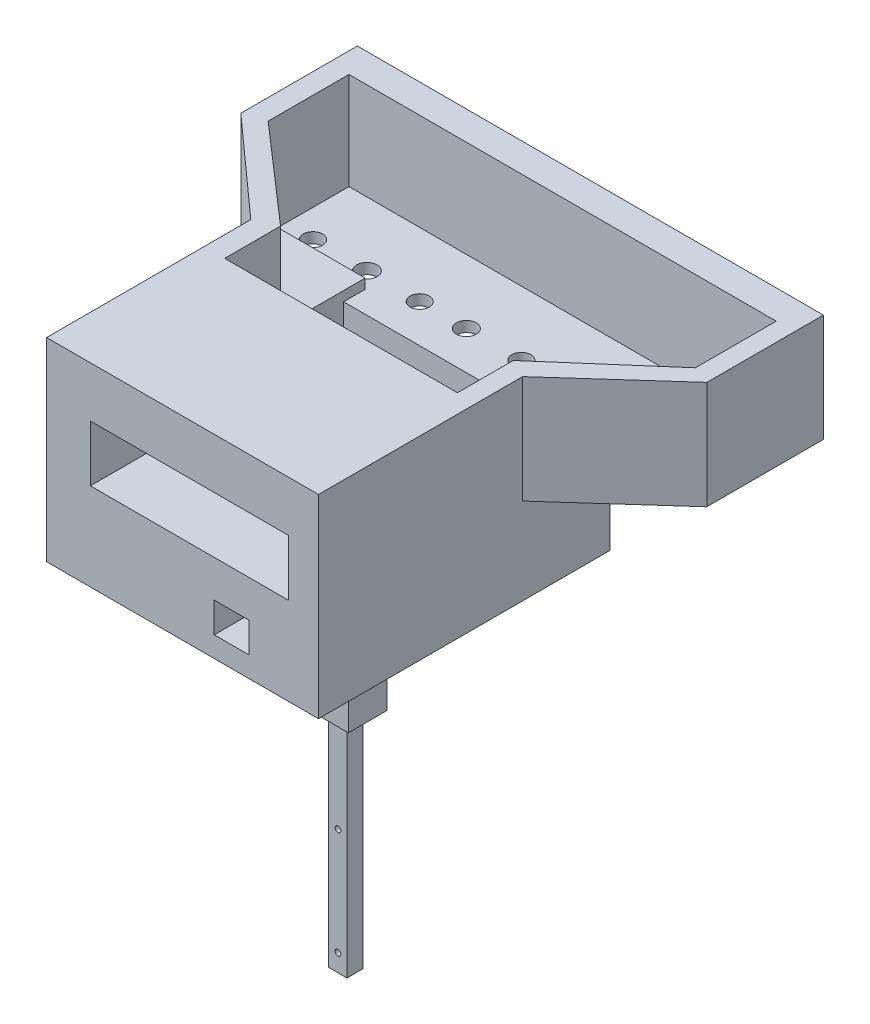
from build123d import *

# Parameters (mm, degrees)
SKETCH_8_W           = 140
SKETCH_8_H           = 130
EXTRUDE_2_DEPTH      = 100
SKETCH_9_W           = 119.853608507
SKETCH_9_H           = 114.241733861
CUT_EXTRUDE_2_DEPTH  = 90
SKETCH_10_W          = 140
SKETCH_10_H          = 55.45062913
EXTRUDE_3_DEPTH      = 60
SKETCH_11_W          = 119.853608507
SKETCH_11_H          = 52.765862156
CUT_EXTRUDE_3_DEPTH  = 50
SKETCH_12_W          = 60
SKETCH_12_H          = 55.45062913
EXTRUDE_4_DEPTH      = 50
SKETCH_13_W          = 60
SKETCH_13_H          = 55.45062913
EXTRUDE_5_DEPTH      = 50
SKETCH_15_W          = 41.61767962
SKETCH_15_H          = 50
CUT_EXTRUDE_5_DEPTH  = 50
SKETCH_16_W          = 41.61767962
SKETCH_16_H          = 49.940605531
CUT_EXTRUDE_6_DEPTH  = 220
SKETCH_18_W          = 140
SKETCH_18_H          = 100
EXTRUDE_6_DEPTH      = 20
SKETCH_19_W          = 119.853608507
SKETCH_19_H          = 90
CUT_EXTRUDE_7_DEPTH  = 17
CUT_EXTRUDE_8_DEPTH  = 17
SKETCH_29_R          = 5.01352521
SKETCH_29_R_2        = 5.249816441
SKETCH_29_R_3        = 4.93835751
SKETCH_29_R_4        = 5.104719563
SKETCH_29_R_5        = 4.942569228
SKETCH_29_R_6        = 5.218376227
SKETCH_29_R_7        = 5.109275874
SKETCH_29_R_8        = 4.846735289
CUT_EXTRUDE_9_DEPTH  = 17
EXTRUDE_9_DEPTH      = 4
SKETCH_37_W          = 2
SKETCH_37_H          = 96
EXTRUDE_10_DEPTH     = 4
SKETCH_39_W          = 84
SKETCH_39_H          = 94.106669422
CUT_EXTRUDE_10_DEPTH = 4
SKETCH_40_W          = 2.323035316
SKETCH_40_H          = 2.081311216
CUT_EXTRUDE_12_DEPTH = 94
SKETCH_42_W          = 2.095402412
SKETCH_42_H          = 1.958248824
CUT_EXTRUDE_13_DEPTH = 94
SKETCH_43_W          = 9.619264996
SKETCH_43_H          = 8.129833148
EXTRUDE_11_DEPTH     = 135
SKETCH_44_R          = 1.5
CUT_EXTRUDE_14_DEPTH = 40
SKETCH_45_W          = 19.969543159
SKETCH_45_H          = 19.838905337
EXTRUDE_12_DEPTH     = 20
EXTRUDE_13_DEPTH     = 55.5
CUT_EXTRUDE_15_DEPTH = 45
SKETCH_50_W          = 119.853608507
SKETCH_50_H          = 70
EXTRUDE_14_DEPTH     = 90
SKETCH_51_W          = 102.080516597
SKETCH_51_H          = 36.944055187
CUT_EXTRUDE_17_DEPTH = 70
SKETCH_52_W          = 102.571773441
SKETCH_52_H          = 2.896860024
EXTRUDE_16_DEPTH     = 8
SKETCH_54_W          = 65.620335911
SKETCH_54_H          = 1.893330578
CUT_EXTRUDE_18_DEPTH = 4
SKETCH_55_W          = 6.653347609
SKETCH_55_H          = 11.160454054
EXTRUDE_17_DEPTH     = 8
SKETCH_56_W          = 4.450383643
SKETCH_56_H          = 9.96038244
EXTRUDE_18_DEPTH     = 8
SKETCH_57_R          = 1.5
CUT_EXTRUDE_19_DEPTH = 20
SKETCH_58_W          = 17.801534575
SKETCH_58_H          = 15.470381237
CUT_EXTRUDE_21_DEPTH = 45
SKETCH_59_W          = 17.801534575
SKETCH_59_H          = 13.564090588
CUT_EXTRUDE_22_DEPTH = 25
SKETCH_62_W          = 17.801534575
SKETCH_62_H          = 40.082559496
CUT_REVOLVE_1_ANGLE  = 45


with BuildPart() as part:
    # 草图8 → 凸台-拉伸2 (new body)
    with BuildSketch(Plane(origin=(0, 0, 0), x_dir=(1, 0, 0), z_dir=(0, 1, 0))):
        with Locations((1.794871795, 32.423076923)):
            Rectangle(SKETCH_8_W, SKETCH_8_H)
    extrude(amount=EXTRUDE_2_DEPTH)

    # 草图9 → 切除-拉伸2 (cut)
    with BuildSketch(Plane(origin=(0, 100, 0), x_dir=(1, 0, 0), z_dir=(0, 1, 0))):
        with Locations((2.262528015, 32.69030905)):
            Rectangle(SKETCH_9_W, SKETCH_9_H)
    extrude(amount=-CUT_EXTRUDE_2_DEPTH, mode=Mode.SUBTRACT)

    # 草图10 → 凸台-拉伸3 (add)
    with BuildSketch(Plane(origin=(0, 0, -97.423076923), x_dir=(-1, 0, 0), z_dir=(0, 0, -1))):
        with Locations((-1.794871795, 72.274685435)):
            Rectangle(SKETCH_10_W, SKETCH_10_H)
    extrude(amount=EXTRUDE_3_DEPTH)

    # 草图11 → 切除-拉伸3 (cut)
    with BuildSketch(Plane(origin=(0, 100, 0), x_dir=(1, 0, 0), z_dir=(0, 1, 0))):
        with Locations((2.262528015, 116.194107058)):
            Rectangle(SKETCH_11_W, SKETCH_11_H)
    extrude(amount=-CUT_EXTRUDE_3_DEPTH, mode=Mode.SUBTRACT)

    # 草图12 → 凸台-拉伸4 (add)
    with BuildSketch(Plane.ZY.offset(68.205128205)):
        with Locations((-127.423076923, 72.274685435)):
            Rectangle(SKETCH_12_W, SKETCH_12_H)
    extrude(amount=EXTRUDE_4_DEPTH)

    # 草图13 → 凸台-拉伸5 (add)
    with BuildSketch(Plane(origin=(71.794871795, 0, 0), x_dir=(0, 0, -1), z_dir=(1, 0, 0))):
        with Locations((127.423076923, 72.274685435)):
            Rectangle(SKETCH_13_W, SKETCH_13_H)
    extrude(amount=EXTRUDE_5_DEPTH)

    # 草图15 → 切除-拉伸5 (cut)
    with BuildSketch(Plane(origin=(-57.664276238, 0, 0), x_dir=(0, 0, -1), z_dir=(1, 0, 0))):
        with Locations((121.768198326, 75)):
            Rectangle(SKETCH_15_W, SKETCH_15_H)
    extrude(amount=-CUT_EXTRUDE_5_DEPTH, mode=Mode.SUBTRACT)

    # 草图16 → 切除-拉伸6 (cut)
    with BuildSketch(Plane(origin=(-107.664276238, 0, 0), x_dir=(0, 0, -1), z_dir=(1, 0, 0))):
        with Locations((121.768198326, 75.029697235)):
            Rectangle(SKETCH_16_W, SKETCH_16_H)
    extrude(amount=CUT_EXTRUDE_6_DEPTH, mode=Mode.SUBTRACT)

    # 草图18 → 凸台-拉伸6 (add)
    with BuildSketch(Plane.XY.offset(32.576923077)):
        with Locations((1.794871795, 50)):
            Rectangle(SKETCH_18_W, SKETCH_18_H)
    extrude(amount=EXTRUDE_6_DEPTH)

    # 草图19 → 切除-拉伸7 (cut)
    with BuildSketch(Plane(origin=(0, 0, 24.430557881), x_dir=(-1, 0, 0), z_dir=(0, 0, -1))):
        with Locations((-2.262528015, 55)):
            Rectangle(SKETCH_19_W, SKETCH_19_H)
    extrude(amount=-CUT_EXTRUDE_7_DEPTH, mode=Mode.SUBTRACT)

    # 草图20 → 切除-拉伸8 (cut)
    with BuildSketch(Plane.XZ):
        with BuildLine():
            Line((-42.997677053, -75), (-22.997677053, -75))
            ThreePointArc((-22.997677053, -75), (-17.997677053, -80), (-22.997677053, -85))
            Line((-22.997677053, -85), (-42.997677053, -85))
            ThreePointArc((-42.997677053, -85), (-47.997677053, -80), (-42.997677053, -75))
        make_face()
        with BuildLine():
            Line((22.997677053, -85), (42.997677053, -85))
            ThreePointArc((42.997677053, -85), (47.997677053, -80), (42.997677053, -75))
            Line((42.997677053, -75), (22.997677053, -75))
            ThreePointArc((22.997677053, -75), (17.997677053, -80), (22.997677053, -85))
        make_face()
    extrude(amount=-CUT_EXTRUDE_8_DEPTH, mode=Mode.SUBTRACT)

    # 草图29 → 切除-拉伸9 (cut)
    with BuildSketch(Plane.XZ.offset(-44.54937087)):
        with Locations(Location((-93.309871888, -109.657200503, 0), (0, 0, 270))):
            Circle(SKETCH_29_R)
        with Locations(Location((-65.511669659, -109.657200503, 0), (0, 0, 270))):
            Circle(SKETCH_29_R_2)
        with Locations(Location((-38.174617175, -109.525727046, 0), (0, 0, 270))):
            Circle(SKETCH_29_R_3)
        with Locations(Location((-14.155387991, -109.525727046, 0), (0, 0, 270))):
            Circle(SKETCH_29_R_4)
        with Locations(Location((14.155387991, -109.525727046, 0), (0, 0, 270))):
            Circle(SKETCH_29_R_5)
        with Locations(Location((38.174617175, -109.525727046, 0), (0, 0, 270))):
            Circle(SKETCH_29_R_6)
        with Locations(Location((65.511669659, -109.657200503, 0), (0, 0, 270))):
            Circle(SKETCH_29_R_7)
        with Locations(Location((93.309871888, -109.657200503, 0), (0, 0, 270))):
            Circle(SKETCH_29_R_8)
    extrude(amount=-CUT_EXTRUDE_9_DEPTH, mode=Mode.SUBTRACT)

    # 草图17 → 凸台-拉伸9 (add)
    with BuildSketch(Plane(origin=(0, 0, 0), x_dir=(-1, 0, 0), z_dir=(0, -1, 0))):
        Polygon((44.206117019, 0), (44.206117019, -45.225446523), (-43.793882981, -45.225446523), (-43.793882981, 0), (-43.793882981, 50.774553477), (44.206117019, 50.774553477), align=None)
    extrude(amount=EXTRUDE_9_DEPTH)

    # 草图37 → 凸台-拉伸10 (add)
    with BuildSketch(Plane.XZ.offset(4)):
        with Locations((-45.206117019, -2.774553477)):
            Rectangle(SKETCH_37_W, SKETCH_37_H)
        with Locations((44.793882981, -2.774553477)):
            Rectangle(SKETCH_37_W, SKETCH_37_H)
    extrude(amount=-EXTRUDE_10_DEPTH)

    # 草图39 → 切除-拉伸10 (cut)
    with BuildSketch(Plane.XZ.offset(4)):
        with Locations((0, -3.721218766)):
            Rectangle(SKETCH_39_W, SKETCH_39_H)
    extrude(amount=-CUT_EXTRUDE_10_DEPTH, mode=Mode.SUBTRACT)

    # 草图40 → 切除-拉伸12 (cut)
    with BuildSketch(Plane(origin=(0, 0, -50.774553477), x_dir=(-1, 0, 0), z_dir=(0, 0, -1))):
        with Locations((43.161517658, -1.040655608)):
            Rectangle(SKETCH_40_W, SKETCH_40_H)
    extrude(amount=-CUT_EXTRUDE_12_DEPTH, mode=Mode.SUBTRACT)

    # 草图42 → 切除-拉伸13 (cut)
    with BuildSketch(Plane(origin=(0, 0, -50.774553477), x_dir=(-1, 0, 0), z_dir=(0, 0, -1))):
        with Locations((-43.047701206, -0.979124412)):
            Rectangle(SKETCH_42_W, SKETCH_42_H)
    extrude(amount=-CUT_EXTRUDE_13_DEPTH, mode=Mode.SUBTRACT)

    # 草图43 → 凸台-拉伸11 (add)
    with BuildSketch(Plane.XZ):
        with Locations((54.952979828, 21.790363097)):
            Rectangle(SKETCH_43_W, SKETCH_43_H)
    extrude(amount=EXTRUDE_11_DEPTH)

    # 草图44 → 切除-拉伸14 (cut)
    with BuildSketch(Plane(origin=(0, 0, 17.725446523), x_dir=(-1, 0, 0), z_dir=(0, 0, -1))):
        with Locations((-55.095402412, -71)):
            Circle(SKETCH_44_R)
        with Locations((-55.095402412, -127)):
            Circle(SKETCH_44_R)
    extrude(amount=-CUT_EXTRUDE_14_DEPTH, mode=Mode.SUBTRACT)

    # 草图45 → 凸台-拉伸12 (add)
    with BuildSketch(Plane.XZ):
        with Locations((55.778654561, 21.231716271)):
            Rectangle(SKETCH_45_W, SKETCH_45_H)
    extrude(amount=EXTRUDE_12_DEPTH)

    # 草图46 → 凸台-拉伸13 (add)
    with BuildSketch(Plane(origin=(0, 100, 0), x_dir=(1, 0, 0), z_dir=(0, 1, 0))):
        Polygon((-118.205128205, 97.423076923), (-68.205128205, 52.570357533), (-68.205128205, 97.423076923), align=None)
        Polygon((71.794871795, 97.423076923), (71.794871795, 52.570357533), (121.794871795, 97.423076923), align=None)
    extrude(amount=-EXTRUDE_13_DEPTH)

    # 草图47 → 切除-拉伸15 (cut)
    with BuildSketch(Plane(origin=(0, 100, 0), x_dir=(1, 0, 0), z_dir=(0, 1, 0))):
        Polygon((-107.664276238, 100.959358516), (-57.664276238, 57.344666553), (-57.664276238, 100.959358516), align=None)
        Polygon((112.335723762, 100.959358516), (62.189332269, 57.344666553), (62.189332269, 100.959358516), align=None)
    extrude(amount=-CUT_EXTRUDE_15_DEPTH, mode=Mode.SUBTRACT)

    # 草图50 → 凸台-拉伸14 (add)
    with BuildSketch(Plane(origin=(0, 10, 0), x_dir=(1, 0, 0), z_dir=(0, 1, 0))):
        with Locations((2.262528015, -6.430557881)):
            Rectangle(SKETCH_50_W, SKETCH_50_H)
    extrude(amount=EXTRUDE_14_DEPTH)

    # 草图51 → 切除-拉伸17 (cut)
    with BuildSketch(Plane.XY.offset(52.576923077)):
        with Locations((5.343057287, 63.574399949)):
            Rectangle(SKETCH_51_W, SKETCH_51_H)
    extrude(amount=-CUT_EXTRUDE_17_DEPTH, mode=Mode.SUBTRACT)

    # 草图52 → 凸台-拉伸16 (add)
    with BuildSketch(Plane.XZ.offset(-82.046427542)):
        with Locations((5.588685709, 51.128493065)):
            Rectangle(SKETCH_52_W, SKETCH_52_H)
    extrude(amount=EXTRUDE_16_DEPTH)

    # 草图54 → 切除-拉伸18 (cut)
    with BuildSketch(Plane.XZ.offset(4)):
        with Locations((0.307674718, 44.278781234)):
            Rectangle(SKETCH_54_W, SKETCH_54_H)
    extrude(amount=-CUT_EXTRUDE_18_DEPTH, mode=Mode.SUBTRACT)

    # 草图55 → 凸台-拉伸17 (add)
    with BuildSketch(Plane(origin=(0, 0, 17.725446523), x_dir=(-1, 0, 0), z_dir=(0, 0, -1))):
        with Locations((-54.914340612, -127.919346869)):
            Rectangle(SKETCH_55_W, SKETCH_55_H)
    extrude(amount=-EXTRUDE_17_DEPTH)

    # 草图56 → 凸台-拉伸18 (add)
    with BuildSketch(Plane.XY.offset(25.855279671)):
        with Locations((55.093514005, -127.911898971)):
            Rectangle(SKETCH_56_W, SKETCH_56_H)
    extrude(amount=-EXTRUDE_18_DEPTH)

    # 草图57 → 切除-拉伸19 (cut)
    with BuildSketch(Plane(origin=(0, 0, 17.725446523), x_dir=(-1, 0, 0), z_dir=(0, 0, -1))):
        with Locations((-55.095402412, -126)):
            Circle(SKETCH_57_R)
    extrude(amount=-CUT_EXTRUDE_19_DEPTH, mode=Mode.SUBTRACT)

    # 草图58 → 切除-拉伸21 (cut)
    with BuildSketch(Plane.XY.offset(52.576923077)):
        with Locations((27.013712443, 18.31499218)):
            Rectangle(SKETCH_58_W, SKETCH_58_H)
    extrude(amount=-CUT_EXTRUDE_21_DEPTH, mode=Mode.SUBTRACT)

    # 草图59 → 切除-拉伸22 (cut)
    with BuildSketch(Plane.XZ.offset(-26.050182799)):
        with Locations((27.013712443, 14.545045525)):
            Rectangle(SKETCH_59_W, SKETCH_59_H)
    extrude(amount=-CUT_EXTRUDE_22_DEPTH, mode=Mode.SUBTRACT)

    # 草图62 → 切除-旋转1 (revolve, cut)
    with BuildSketch(Plane(origin=(0, 10.579801562, 0), x_dir=(1, 0, 0), z_dir=(0, 1, 0))):
        with Locations((27.013712443, -32.535643329)):
            Rectangle(SKETCH_62_W, SKETCH_62_H)
    revolve(axis=Axis((18.112945155, 10.579801562, 52.576923077), (1, 0, 0)), revolution_arc=CUT_REVOLVE_1_ANGLE, mode=Mode.SUBTRACT)


solid = part.part
